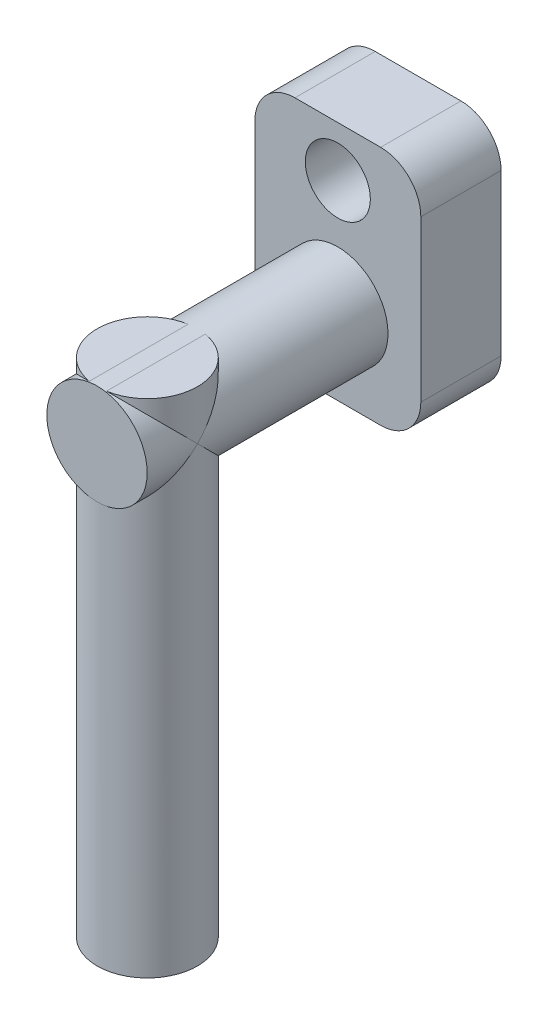
from build123d import *

# Parameters (mm, degrees)
SCHIZZO1_W                   = 8.27
SCHIZZO1_H                   = 12
ESTRUSIONE_ESTRUSIONE1_DEPTH = 4
RACCORDO1_R                  = 2
RACCORDO2_R                  = 2
SCHIZZO3_R                   = 1.62
TAGLIO_ESTRUSIONE1_DEPTH     = 4
SCHIZZO4_R                   = 2.5
ESTRUSIONE_ESTRUSIONE2_DEPTH = 12
SCHIZZO5_R                   = 2.5
ESTRUSIONE_ESTRUSIONE3_DEPTH = 25


with BuildPart() as part:
    # Schizzo1 → Estrusione-Estrusione1 (new body)
    with BuildSketch(Plane.XY):
        Rectangle(SCHIZZO1_W, SCHIZZO1_H)
    extrude(amount=ESTRUSIONE_ESTRUSIONE1_DEPTH)

    # Raccordo1
    raccordo1_edges = [part.edges().sort_by_distance(p)[0] for p in [
        (4.135, 6, 2),
    ]]
    fillet(raccordo1_edges, radius=RACCORDO1_R)

    # Raccordo2
    raccordo2_edges = [part.edges().sort_by_distance(p)[0] for p in [
        (4.135, -6, 2),
        (-4.135, -6, 2),
        (-4.135, 6, 2),
    ]]
    fillet(raccordo2_edges, radius=RACCORDO2_R)

    # Schizzo3 → Taglio-Estrusione1 (cut)
    with BuildSketch(Plane.XY.offset(4)):
        with Locations((0, 3.5)):
            Circle(SCHIZZO3_R)
    extrude(amount=-TAGLIO_ESTRUSIONE1_DEPTH, mode=Mode.SUBTRACT)

    # Schizzo4 → Estrusione-Estrusione2 (add)
    with BuildSketch(Plane.XY.offset(4)):
        with Locations((0, -1.86312089)):
            Circle(SCHIZZO4_R)
    extrude(amount=ESTRUSIONE_ESTRUSIONE2_DEPTH)

    # Schizzo5 → Estrusione-Estrusione3 (add)
    with BuildSketch(Plane(origin=(0, 0.6, 0), x_dir=(1, 0, 0), z_dir=(0, 1, 0))):
        with Locations(Location((0, -13.4915802, 0), (0, 0, 270))):
            Circle(SCHIZZO5_R)
    extrude(amount=-ESTRUSIONE_ESTRUSIONE3_DEPTH)


solid = part.part
